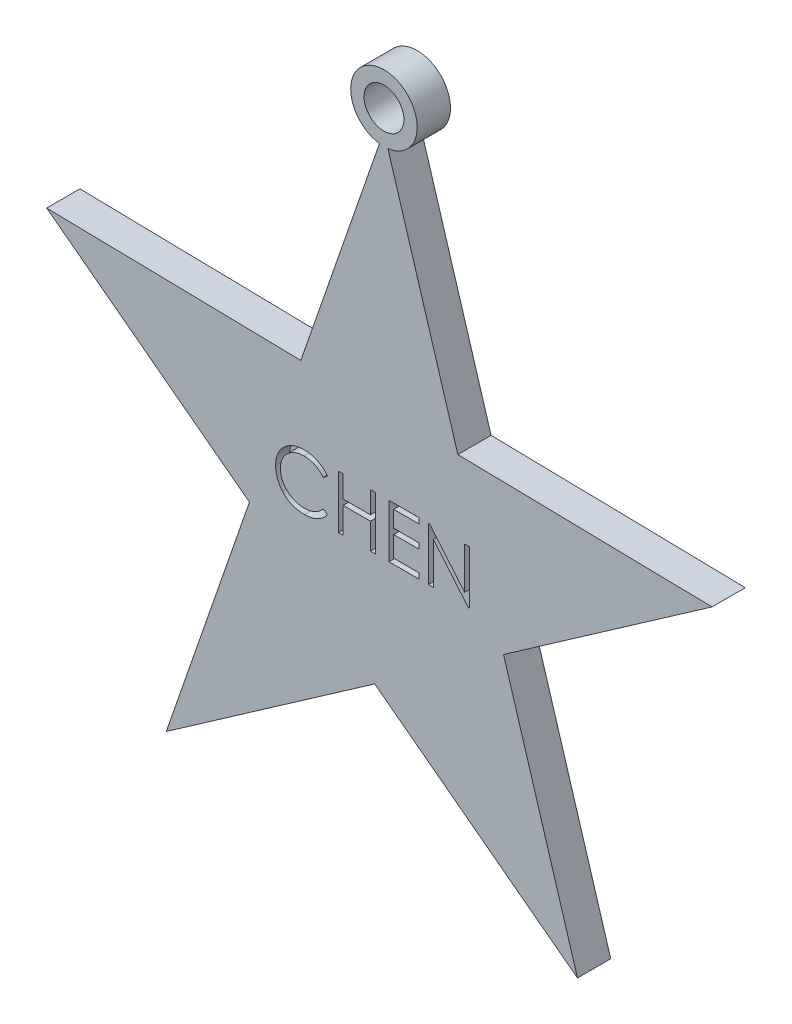
from build123d import *

# Parameters (mm, degrees)
EXTRUDE_1_DEPTH     = 2.5
CUT_EXTRUDE_1_DEPTH = 1
SKETCH_4_R          = 1.5
CUT_EXTRUDE_3_DEPTH = 2.5


with BuildPart() as part:
    # 草图1 → 凸台-拉伸1 (new body)
    with BuildSketch(Plane.XY):
        with BuildLine():
            Line((-24.844384519, 8.60192761), (-9.608590106, -2.919770039))
            Line((-9.608590106, -2.919770039), (-15.858256337, -20.970271974))
            Line((-15.858256337, -20.970271974), (-0.192351313, -10.040570794))
            Line((-0.192351313, -10.040570794), (15.0434431, -21.562268443))
            Line((15.0434431, -21.562268443), (9.487934055, -3.286883328))
            Line((9.487934055, -3.286883328), (25.155615481, 7.644057202))
            Line((25.155615481, 7.644057202), (6.053810642, 8.009998274))
            Line((6.053810642, 8.009998274), (0.799130777, 25.295776665))
            ThreePointArc((0.799130777, 25.295776665), (0.520604646, 30.277806022), (0.162308714, 25.300877517))
            Line((0.162308714, 25.300877517), (-5.746083956, 8.236053671))
            Line((-5.746083956, 8.236053671), (-24.844384519, 8.60192761))
        make_face()
    extrude(amount=EXTRUDE_1_DEPTH)

    # 草图2 → 切除-拉伸1 (cut)
    with BuildSketch(Plane.XY.offset(2.5)):
        with BuildLine():
            Line((-3.743094252, 1.70920022), (-4.057196816, 1.468815604))
            add(Edge.make_bspline(
                [(-4.057196816, 1.468815604), (-4.079603546, 1.49551957), (-4.124114914, 1.548567474), (-4.195725431, 1.623058382), (-4.27035588, 1.692847252), (-4.347977733, 1.758266543), (-4.429988155, 1.817028561), (-4.514400496, 1.872195536), (-4.602626834, 1.921644379), (-4.724628816, 1.981602077), (-4.884226357, 2.044169112), (-5.085134745, 2.096629947), (-5.294861714, 2.130025577), (-5.437944685, 2.133642538), (-5.510722457, 2.135482271)],
                knots=[0, 0, 0, 0, 0.757959112, 1.505699292, 2.245454638, 2.979532153, 3.711538275, 4.438200793, 5.171680507, 5.909471876, 7.393775596, 8.890124382, 10.418191784, 12, 12, 12, 12], degree=3))
            add(Edge.make_bspline(
                [(-5.510722457, 2.135482271), (-5.550817657, 2.1350206), (-5.630635934, 2.134101541), (-5.749091332, 2.121976827), (-5.865334819, 2.104935444), (-5.979290781, 2.07964936), (-6.090814162, 2.047680653), (-6.20063405, 2.00948018), (-6.30716045, 1.962217506), (-6.411867008, 1.909979494), (-6.512186106, 1.8509767), (-6.60710616, 1.786618584), (-6.696280981, 1.717625331), (-6.779781109, 1.643738352), (-6.857691907, 1.565290397), (-6.929448834, 1.481445435), (-6.994803588, 1.392471523), (-7.055051617, 1.299541914), (-7.109009027, 1.202927295), (-7.154186032, 1.102270072), (-7.194191886, 0.999293954), (-7.225848163, 0.892835485), (-7.250904753, 0.783643752), (-7.268193512, 0.671425709), (-7.280180336, 0.556415789), (-7.281094824, 0.478462289), (-7.281555791, 0.439168169)],
                knots=[0, 0, 0, 0, 1.054917814, 2.100044995, 3.131103042, 4.146048494, 5.169673617, 6.183595914, 7.203665975, 8.234915748, 9.262203917, 10.264457458, 11.251630812, 12.227803204, 13.197192746, 14.159520551, 15.12972552, 16.100847026, 17.073214652, 18.039054194, 19.002613845, 19.979014051, 20.95965708, 21.949030935, 22.966165397, 24, 24, 24, 24], degree=3))
            add(Edge.make_bspline(
                [(-7.281555791, 0.439168169), (-7.280113712, 0.38004666), (-7.277282381, 0.26396942), (-7.252084285, 0.093945865), (-7.213792752, -0.068934905), (-7.156403521, -0.223654725), (-7.085638892, -0.372121419), (-6.996221051, -0.511822966), (-6.892659294, -0.644870468), (-6.773488528, -0.768119552), (-6.642739024, -0.880706666), (-6.502455697, -0.979850188), (-6.352987939, -1.062495768), (-6.195986076, -1.131268278), (-6.030241946, -1.18413311), (-5.856053601, -1.221349251), (-5.673799892, -1.245626029), (-5.549263435, -1.247950244), (-5.485882714, -1.249133114)],
                knots=[0, 0, 0, 0, 1.029171465, 2.020641659, 2.987623507, 3.938342917, 4.889210282, 5.84687017, 6.821220943, 7.821438502, 8.827599549, 9.822697543, 10.807740252, 11.797342354, 12.80366471, 13.83203677, 14.896651826, 16, 16, 16, 16], degree=3))
            add(Edge.make_bspline(
                [(-5.485882714, -1.249133114), (-5.416051069, -1.24720308), (-5.278605688, -1.243404311), (-5.077042229, -1.211222312), (-4.884087068, -1.159041834), (-4.699729826, -1.086015637), (-4.524490231, -0.99108388), (-4.358094048, -0.876000591), (-4.200400824, -0.739671068), (-4.105576502, -0.635576065), (-4.057196816, -0.582466447)],
                knots=[0, 0, 0, 0, 1.028121516, 2.023589091, 2.998037872, 3.967518031, 4.937445131, 5.927275754, 6.942489185, 8, 8, 8, 8], degree=3))
            Line((-4.057196816, -0.582466447), (-3.743094252, -0.820447216))
            add(Edge.make_bspline(
                [(-3.743094252, -0.820447216), (-3.768372092, -0.85306259), (-3.818806692, -0.918137111), (-3.900472998, -1.009876208), (-3.986504195, -1.096166534), (-4.077539292, -1.176312387), (-4.172531054, -1.251917491), (-4.273185125, -1.320833869), (-4.378178305, -1.384023451), (-4.487154852, -1.441882794), (-4.599998981, -1.49321679), (-4.716575478, -1.537163953), (-4.83638185, -1.57502097), (-4.959423574, -1.606166041), (-5.085955868, -1.630475851), (-5.215522124, -1.646726908), (-5.348401981, -1.657860524), (-5.438049319, -1.658875285), (-5.483478868, -1.659389524)],
                knots=[0, 0, 0, 0, 0.986787822, 1.968848986, 2.935600012, 3.899624008, 4.868462664, 5.837806735, 6.815139263, 7.798259679, 8.787526145, 9.778297419, 10.776456485, 11.791383307, 12.812564526, 13.85620153, 14.913611965, 16, 16, 16, 16], degree=3))
            add(Edge.make_bspline(
                [(-5.483478868, -1.659389524), (-5.526500201, -1.659090104), (-5.611569562, -1.658498038), (-5.737168135, -1.648906989), (-5.859441941, -1.635821576), (-5.978041514, -1.616118569), (-6.093614057, -1.592867894), (-6.205111868, -1.561700744), (-6.313632108, -1.526787411), (-6.418738783, -1.48575314), (-6.520521297, -1.439448931), (-6.618651367, -1.387115721), (-6.713083861, -1.32919359), (-6.8047472, -1.266959293), (-6.892287295, -1.198413805), (-6.976462753, -1.12450908), (-7.057745583, -1.04549421), (-7.108034366, -0.988517235), (-7.133318611, -0.959870293)],
                knots=[0, 0, 0, 0, 1.114604814, 2.203992996, 3.262667896, 4.300477797, 5.318619304, 6.316056647, 7.298880507, 8.271930387, 9.238335007, 10.195173496, 11.151986948, 12.108099108, 13.064862484, 14.031167946, 15.010108607, 16, 16, 16, 16], degree=3))
            add(Edge.make_bspline(
                [(-7.133318611, -0.959870293), (-7.17381649, -0.910108934), (-7.25432332, -0.81118698), (-7.357324101, -0.650860144), (-7.445492736, -0.483467905), (-7.516779503, -0.308130844), (-7.57250834, -0.125242401), (-7.61111542, 0.065289615), (-7.636202968, 0.263287264), (-7.63907187, 0.397957879), (-7.64053015, 0.466411758)],
                knots=[0, 0, 0, 0, 0.994628077, 1.977248131, 2.950237994, 3.925870899, 4.908910175, 5.911660606, 6.938484602, 8, 8, 8, 8], degree=3))
            add(Edge.make_bspline(
                [(-7.64053015, 0.466411758), (-7.638752786, 0.538360848), (-7.635255933, 0.67991619), (-7.605546452, 0.887657851), (-7.557753542, 1.086688021), (-7.489871384, 1.276635158), (-7.403808125, 1.458498335), (-7.297491995, 1.630888284), (-7.172158118, 1.794907483), (-7.02878947, 1.948067199), (-6.871569658, 2.088112174), (-6.703205299, 2.211319264), (-6.524025931, 2.313853568), (-6.336005529, 2.399563468), (-6.137736179, 2.465442854), (-5.9296409, 2.511560782), (-5.712110712, 2.540266057), (-5.563696511, 2.543894866), (-5.48828656, 2.545738681)],
                knots=[0, 0, 0, 0, 1.032925535, 2.032216505, 3.007276963, 3.968222605, 4.92396291, 5.891752235, 6.871517503, 7.883894988, 8.900124299, 9.891468569, 10.874487609, 11.85992873, 12.854644235, 13.869047385, 14.917252991, 16, 16, 16, 16], degree=3))
            add(Edge.make_bspline(
                [(-5.48828656, 2.545738681), (-5.442327163, 2.545187666), (-5.351355167, 2.544096987), (-5.216780707, 2.533461396), (-5.085760904, 2.515731561), (-4.958205496, 2.49159891), (-4.833493935, 2.461647685), (-4.712579374, 2.422630201), (-4.594752303, 2.378017023), (-4.480755837, 2.326635919), (-4.371136922, 2.268959643), (-4.265929701, 2.205627502), (-4.165969863, 2.13671801), (-4.070554036, 2.062817238), (-3.981278366, 1.982361741), (-3.895608105, 1.897564489), (-3.816452587, 1.805982975), (-3.767591793, 1.741520194), (-3.743094252, 1.70920022)],
                knots=[0, 0, 0, 0, 1.096760587, 2.17092713, 3.219439832, 4.250915756, 5.268269357, 6.278326846, 7.281116186, 8.274029601, 9.260640565, 10.235837813, 11.203064059, 12.156899882, 13.114053108, 14.069676657, 15.032185724, 16, 16, 16, 16], degree=3))
        make_face()
        Polygon((-2.922581432, 2.443174579), (-2.563607073, 2.443174579), (-2.563607073, 0.802148938), (-0.512325021, 0.802148938), (-0.512325021, 2.443174579), (-0.153350663, 2.443174579), (-0.153350663, -1.556825421), (-0.512325021, -1.556825421), (-0.512325021, 0.391892527), (-2.563607073, 0.391892527), (-2.563607073, -1.556825421), (-2.922581432, -1.556825421), align=None)
        Polygon((0.872290363, 2.443174579), (3.12870062, 2.443174579), (3.12870062, 2.032918169), (1.231264722, 2.032918169), (1.231264722, 0.802148938), (3.12870062, 0.802148938), (3.12870062, 0.391892527), (1.231264722, 0.391892527), (1.231264722, -1.146569011), (3.12870062, -1.146569011), (3.12870062, -1.556825421), (0.872290363, -1.556825421), align=None)
        Polygon((3.846649337, -1.556825421), (3.846649337, 2.443174579), (3.92196985, 2.443174579), (6.564598055, -0.705062601), (6.564598055, 2.443174579), (6.923572414, 2.443174579), (6.923572414, -1.556825421), (6.841841645, -1.556825421), (4.205623696, 1.58420022), (4.205623696, -1.556825421), align=None)
    extrude(amount=-CUT_EXTRUDE_1_DEPTH, mode=Mode.SUBTRACT)

    # 草图4 → 切除-拉伸3 (cut)
    with BuildSketch(Plane.XY.offset(2.5)):
        with Locations((0.500580653, 27.777886216)):
            Circle(SKETCH_4_R)
    extrude(amount=-CUT_EXTRUDE_3_DEPTH, mode=Mode.SUBTRACT)


solid = part.part
